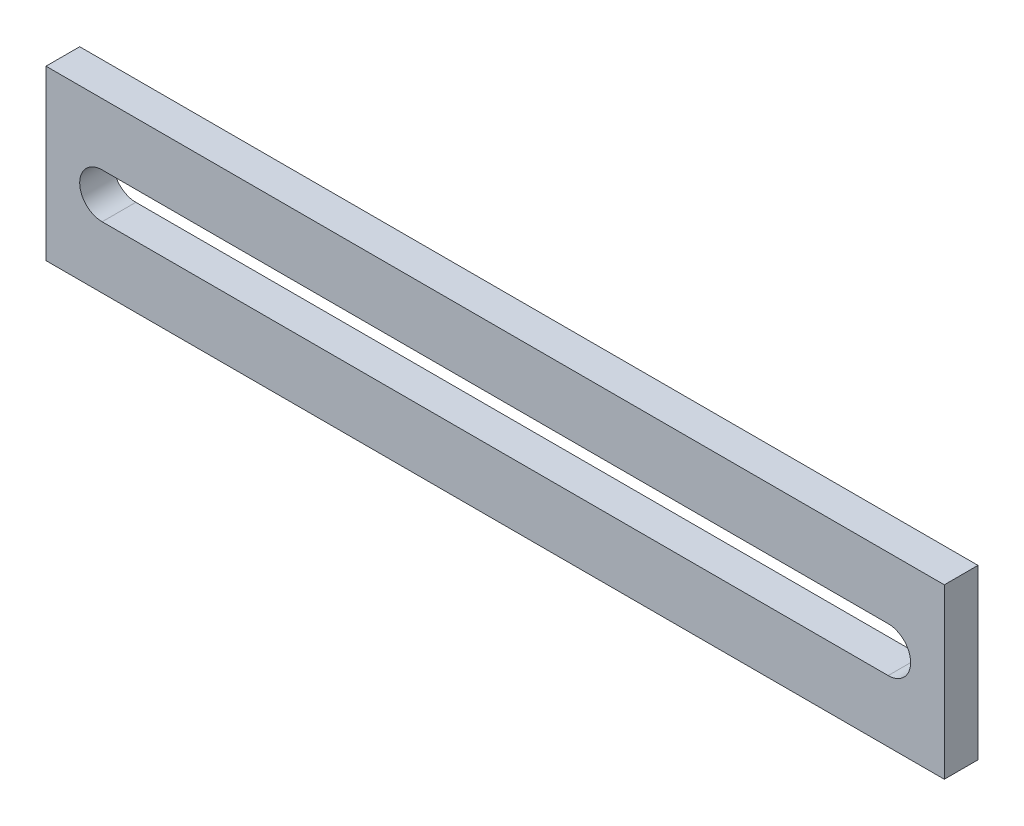
from build123d import *

# Parameters (mm, degrees)
SKETCH1_W           = 80
SKETCH1_H           = 15
BOSS_EXTRUDE1_DEPTH = 3
CUT_EXTRUDE1_DEPTH  = 3


with BuildPart() as part:
    # Sketch1 → Boss-Extrude1 (new body)
    with BuildSketch(Plane.XY):
        Rectangle(SKETCH1_W, SKETCH1_H)
    extrude(amount=BOSS_EXTRUDE1_DEPTH)

    # Sketch2 → Cut-Extrude1 (cut)
    with BuildSketch(Plane.XY.offset(3)):
        with BuildLine():
            Line((-35, 2), (35, 2))
            ThreePointArc((35, 2), (37, 0), (35, -2))
            Line((35, -2), (-35, -2))
            ThreePointArc((-35, -2), (-37, 0), (-35, 2))
        make_face()
    extrude(amount=-CUT_EXTRUDE1_DEPTH, mode=Mode.SUBTRACT)


solid = part.part
